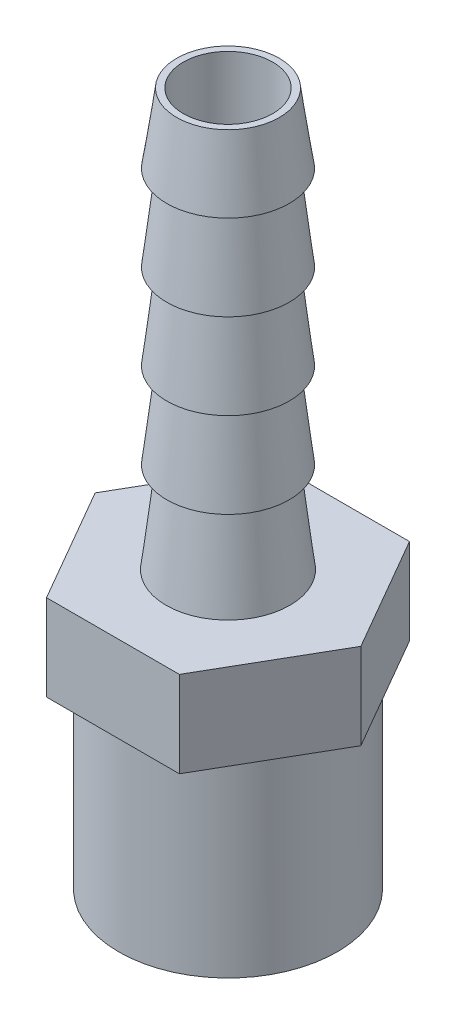
from build123d import *

# Parameters (mm, degrees)
SKETCH1_R           = 2.7
BOSS_EXTRUDE1_DEPTH = 5.2
LOWER_THREADS_R     = 6.6
LOWER_THREADS_R_2   = 4.5
BOSS_EXTRUDE2_DEPTH = 11.5


with BuildPart() as part:
    # Sketch1 → Boss-Extrude1 (new body)
    with BuildSketch(Plane(origin=(0, 0, 0), x_dir=(1, 0, 0), z_dir=(0, 1, 0))):
        Polygon((8.025168742, 0), (4.012584371, 6.95), (-4.012584371, 6.95), (-8.025168742, 0), (-4.012584371, -6.95), (4.012584371, -6.95), align=None)
        with Locations(Location((0, 0, 0), (0, 0, 270))):
            Circle(SKETCH1_R, mode=Mode.SUBTRACT)
    extrude(amount=-BOSS_EXTRUDE1_DEPTH)

    # Sketch2 → Revolve1 (revolve)
    with BuildSketch(Plane.XY, mode=Mode.PRIVATE) as revolve1_sk:
        Polygon((2.7, 0), (2.7, 25.2), (3.1, 25.2), (3.7, 21), (3.1, 21), (3.7, 15.833333333), (3.1, 15.833333333), (3.7, 10.666666667), (3.1, 10.666666667), (3.7, 5.5), (3.1, 5.5), (3.738709677, 0), align=None)
    revolve(revolve1_sk.sketch.rotate(Axis((0, -1.995266411, 0), (0, 1, 0)), 90), axis=Axis((0, -1.995266411, 0), (0, 1, 0)))

    # Lower Threads → Boss-Extrude2 (add)
    with BuildSketch(Plane.XZ.offset(5.2)):
        with Locations(Location((0, 0, 0), (0, 0, 90))):
            Circle(LOWER_THREADS_R)
        with Locations(Location((0, 0, 0), (0, 0, 90))):
            Circle(LOWER_THREADS_R_2, mode=Mode.SUBTRACT)
    extrude(amount=BOSS_EXTRUDE2_DEPTH)


solid = part.part
